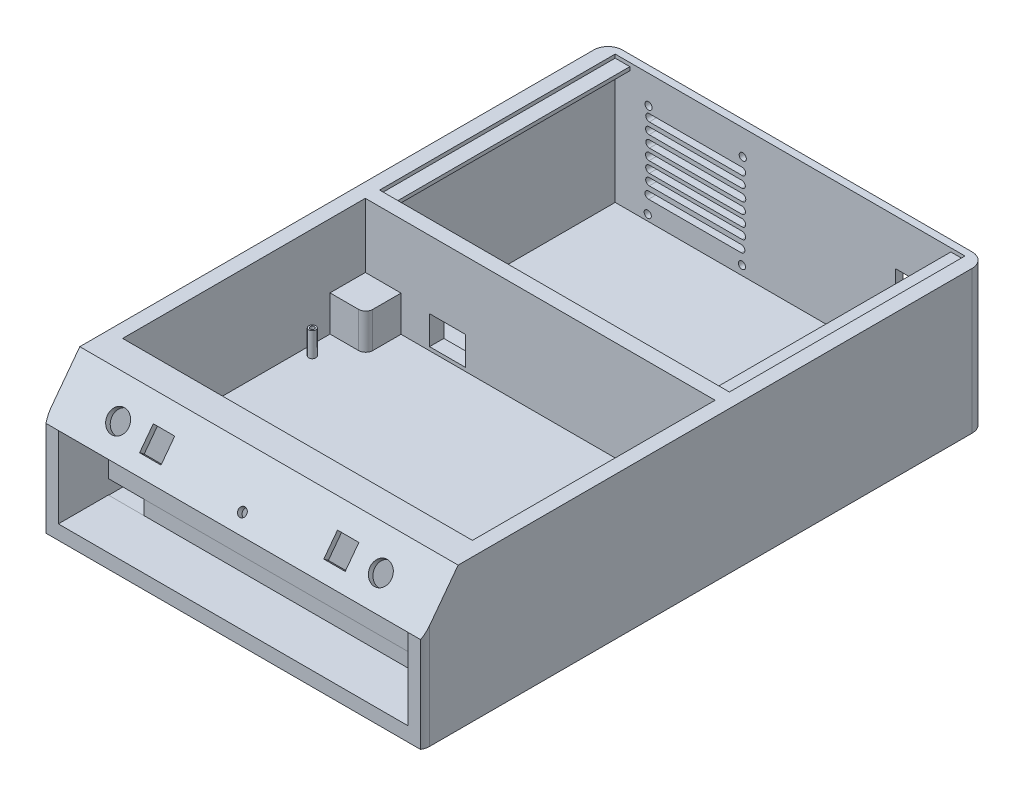
from build123d import *

# Parameters (mm, degrees)
BOSS_EXTRUDE2_DEPTH      = 100
SKETCH4_W                = 245
SKETCH4_H                = 170
CUT_EXTRUDE2_DEPTH       = 70
CUT_EXTRUDE12_DEPTH      = 434.077648927
CUT_EXTRUDE12_DEPTH_BACK = 434.077648927
CUT_EXTRUDE13_DEPTH      = 122.5
CUT_EXTRUDE14_DEPTH      = 122.5
SKETCH16_R               = 2.5
SKETCH16_R_2             = 2.25
SKETCH16_W               = 28.5
SKETCH16_H               = 48
CUT_EXTRUDE15_DEPTH      = 30
SKETCH17_R               = 2.952889484
SKETCH17_R_2             = 7.5
SKETCH17_W               = 15
SKETCH17_H               = 16
CUT_EXTRUDE16_DEPTH      = 10
BOSS_EXTRUDE3_DEPTH      = 25
SKETCH19_W               = 25
SKETCH19_H               = 20
CUT_EXTRUDE17_DEPTH      = 15
SKETCH21_W               = 195.080232819
SKETCH21_H               = 190
BOSS_EXTRUDE9_DEPTH      = 10
SKETCH23_W               = 265
SKETCH23_H               = 73.333333333
CUT_EXTRUDE18_DEPTH      = 5
SKETCH24_W               = 245
SKETCH24_H               = 56.666666667
CUT_EXTRUDE19_DEPTH      = 5
SKETCH25_W               = 245
SKETCH25_H               = 165
CUT_EXTRUDE21_DEPTH      = 2.5
SKETCH26_W               = 224.830514278
SKETCH26_H               = 165
CUT_EXTRUDE22_DEPTH      = 2.5
SKETCH27_R               = 2.5
SKETCH27_R_2             = 1.5
BOSS_EXTRUDE11_DEPTH     = 17


with BuildPart() as part:
    # Sketch1 → Boss-Extrude2 (new body)
    with BuildSketch(Plane(origin=(0, 0, 0), x_dir=(1, 0, 0), z_dir=(0, 1, 0))):
        with BuildLine():
            Line((0, -10), (0, -390))
            ThreePointArc((0, -390), (2.928932188, -397.071067812), (10, -400))
            Line((10, -400), (255, -400))
            ThreePointArc((255, -400), (262.071067812, -397.071067812), (265, -390))
            Line((265, -390), (265, -10))
            ThreePointArc((265, -10), (262.071067812, -2.928932188), (255, 0))
            Line((255, 0), (10, 0))
            ThreePointArc((10, 0), (2.928932188, -2.928932188), (0, -10))
        make_face()
    extrude(amount=BOSS_EXTRUDE2_DEPTH)

    # Sketch4 → Cut-Extrude2 (cut)
    with BuildSketch(Plane(origin=(0, 100, 0), x_dir=(1, 0, 0), z_dir=(0, 1, 0))):
        with Locations((132.5, -265)):
            Rectangle(SKETCH4_W, SKETCH4_H)
    extrude(amount=-CUT_EXTRUDE2_DEPTH, mode=Mode.SUBTRACT)

    # Sketch10 → Cut-Extrude12 (cut, two sides: drawn at the far end of the back side and taken through both)
    with BuildSketch(Plane(origin=(132.5, 0, 0), x_dir=(0, 0, -1), z_dir=(1, 0, 0)).offset(-CUT_EXTRUDE12_DEPTH_BACK)):
        Polygon((-400, 60), (-370, 100), (-400, 100), align=None)
    extrude(amount=CUT_EXTRUDE12_DEPTH + CUT_EXTRUDE12_DEPTH_BACK, mode=Mode.SUBTRACT)

    # Sketch14 → Cut-Extrude13 (cut, symmetric)
    with BuildSketch(Plane(origin=(132.5, 0, 0), x_dir=(0, 0, -1), z_dir=(1, 0, 0))):
        Polygon((-390, 10), (-360, 10), (-360, 96), (-368, 96), (-390, 66.666666667), align=None)
    extrude(amount=CUT_EXTRUDE13_DEPTH, both=True, mode=Mode.SUBTRACT)

    # Sketch15 → Cut-Extrude14 (cut, symmetric)
    with BuildSketch(Plane(origin=(132.5, 0, 0), x_dir=(0, 0, -1), z_dir=(1, 0, 0))):
        Polygon((-360, 9.784104138), (-360, 20), (-170, 20), (-170, 95), (-5, 95), (-5, 10), align=None)
    extrude(amount=CUT_EXTRUDE14_DEPTH, both=True, mode=Mode.SUBTRACT)

    # Sketch16 → Cut-Extrude15 (cut)
    with BuildSketch(Plane(origin=(0, 0, 0), x_dir=(-1, 0, 0), z_dir=(0, 0, -1))):
        with Locations((-99.351479045, 82.346777086)):
            Circle(SKETCH16_R)
        with Locations((-32.789304606, 14.265780679)):
            Circle(SKETCH16_R)
        with Locations((-33.351479045, 80.263386392)):
            Circle(SKETCH16_R)
        with Locations((-98.789304606, 16.349171373)):
            Circle(SKETCH16_R)
        with Locations((-241, 44.598834986)):
            Circle(SKETCH16_R_2)
        with Locations((-201, 44.598834986)):
            Circle(SKETCH16_R_2)
        with BuildLine():
            Line((-98.891846609, 75.787809753), (-33.891846609, 75.787809753))
            ThreePointArc((-33.891846609, 75.787809753), (-31.391846609, 73.287809753), (-33.891846609, 70.787809753))
            Line((-33.891846609, 70.787809753), (-98.891846609, 70.787809753))
            ThreePointArc((-98.891846609, 70.787809753), (-101.391846609, 73.287809753), (-98.891846609, 75.787809753))
        make_face()
        with BuildLine():
            Line((-98.710582977, 67.787809753), (-33.710582977, 67.787809753))
            ThreePointArc((-33.710582977, 67.787809753), (-31.292813717, 65.370040492), (-33.710582977, 62.952271231))
            Line((-33.710582977, 62.952271231), (-98.710582977, 62.952271231))
            ThreePointArc((-98.710582977, 62.952271231), (-101.128352238, 65.370040492), (-98.710582977, 67.787809753))
        make_face()
        with BuildLine():
            Line((-98.976192668, 59.952271231), (-33.976192668, 59.952271231))
            ThreePointArc((-33.976192668, 59.952271231), (-31.476192668, 57.452271231), (-33.976192668, 54.952271231))
            Line((-33.976192668, 54.952271231), (-98.976192668, 54.952271231))
            ThreePointArc((-98.976192668, 54.952271231), (-101.476192668, 57.452271231), (-98.976192668, 59.952271231))
        make_face()
        with BuildLine():
            Line((-98.733660424, 52.195845601), (-33.733660424, 52.195845601))
            ThreePointArc((-33.733660424, 52.195845601), (-31.233660424, 49.695845601), (-33.733660424, 47.195845601))
            Line((-33.733660424, 47.195845601), (-98.733660424, 47.195845601))
            ThreePointArc((-98.733660424, 47.195845601), (-101.233660424, 49.695845601), (-98.733660424, 52.195845601))
        make_face()
        with BuildLine():
            Line((-98.864643365, 44.598834986), (-33.864643365, 44.598834986))
            ThreePointArc((-33.864643365, 44.598834986), (-31.364643365, 42.098834986), (-33.864643365, 39.598834986))
            Line((-33.864643365, 39.598834986), (-98.864643365, 39.598834986))
            ThreePointArc((-98.864643365, 39.598834986), (-101.364643365, 42.098834986), (-98.864643365, 44.598834986))
        make_face()
        with BuildLine():
            Line((-98.864643365, 37.00182437), (-33.864643365, 37.00182437))
            ThreePointArc((-33.864643365, 37.00182437), (-31.364643365, 34.50182437), (-33.864643365, 32.00182437))
            Line((-33.864643365, 32.00182437), (-98.864643365, 32.00182437))
            ThreePointArc((-98.864643365, 32.00182437), (-101.364643365, 34.50182437), (-98.864643365, 37.00182437))
        make_face()
        with BuildLine():
            Line((-98.340711599, 28.618916104), (-33.340711599, 28.618916104))
            ThreePointArc((-33.340711599, 28.618916104), (-30.840711599, 26.118916104), (-33.340711599, 23.618916104))
            Line((-33.340711599, 23.618916104), (-98.340711599, 23.618916104))
            ThreePointArc((-98.340711599, 23.618916104), (-100.840711599, 26.118916104), (-98.340711599, 28.618916104))
        make_face()
        with Locations((-220.75, 44)):
            Rectangle(SKETCH16_W, SKETCH16_H)
    extrude(amount=-CUT_EXTRUDE15_DEPTH, mode=Mode.SUBTRACT)

    # Sketch17 → Cut-Extrude16 (cut)
    with BuildSketch(Plane(origin=(0, 213.6, 284.8), x_dir=(1, 0, 0), z_dir=(0, 0.5999999999999998, 0.8000000000000004))):
        with Locations(Location((132.5, -173, 0), (0, 0, 270))):
            Circle(SKETCH17_R)
        with Locations(Location((40.5, -164.727732251, 0), (0, 0, 270))):
            Circle(SKETCH17_R_2)
        with Locations(Location((224.5, -164.727732251, 0), (0, 0, 270))):
            Circle(SKETCH17_R_2)
        with Locations((68, -165)):
            Rectangle(SKETCH17_W, SKETCH17_H)
        with Locations((197, -165)):
            Rectangle(SKETCH17_W, SKETCH17_H)
    extrude(amount=-CUT_EXTRUDE16_DEPTH, mode=Mode.SUBTRACT)

    # Sketch18 → Boss-Extrude3 (add)
    with BuildSketch(Plane(origin=(0, 30, 0), x_dir=(1, 0, 0), z_dir=(0, 1, 0))):
        with BuildLine():
            Line((10, -180), (10, -204.729927007))
            Line((10, -204.729927007), (30, -204.729927007))
            ThreePointArc((30, -204.729927007), (33.43872324, -203.359690427), (34.99270073, -200))
            Line((34.99270073, -200), (34.99270073, -180))
            Line((34.99270073, -180), (10, -180))
        make_face()
        with BuildLine():
            Line((255, -350), (255, -324.14910859))
            Line((255, -324.14910859), (235, -324.14910859))
            ThreePointArc((235, -324.14910859), (231.175444009, -325.928429861), (230.072933549, -330))
            Line((230.072933549, -330), (230.072933549, -350))
            Line((230.072933549, -350), (255, -350))
        make_face()
    extrude(amount=BOSS_EXTRUDE3_DEPTH)

    # Sketch19 → Cut-Extrude17 (cut)
    with BuildSketch(Plane.XY.offset(180)):
        with Locations((67.49270073, 42.5)):
            Rectangle(SKETCH19_W, SKETCH19_H)
    extrude(amount=-CUT_EXTRUDE17_DEPTH, mode=Mode.SUBTRACT)

    # Sketch23 → Cut-Extrude18 (cut)
    with BuildSketch(Plane.XY.offset(400)):
        with Locations((132.5, 36.666666666)):
            Rectangle(SKETCH23_W, SKETCH23_H)
    extrude(amount=-CUT_EXTRUDE18_DEPTH, mode=Mode.SUBTRACT)

    # Sketch24 → Cut-Extrude19 (cut)
    with BuildSketch(Plane.XY.offset(395)):
        with Locations((132.5, 38.333333334)):
            Rectangle(SKETCH24_W, SKETCH24_H)
    extrude(amount=-CUT_EXTRUDE19_DEPTH, mode=Mode.SUBTRACT)

    # Sketch25 → Cut-Extrude21 (cut)
    with BuildSketch(Plane(origin=(0, 100, 0), x_dir=(1, 0, 0), z_dir=(0, 1, 0))):
        with Locations((132.5, -87.5)):
            Rectangle(SKETCH25_W, SKETCH25_H)
    extrude(amount=-CUT_EXTRUDE21_DEPTH, mode=Mode.SUBTRACT)

    # Sketch26 → Cut-Extrude22 (cut)
    with BuildSketch(Plane(origin=(0, 97.5, 0), x_dir=(1, 0, 0), z_dir=(0, 1, 0))):
        with Locations((132.6965421, -87.5)):
            Rectangle(SKETCH26_W, SKETCH26_H)
    extrude(amount=-CUT_EXTRUDE22_DEPTH, mode=Mode.SUBTRACT)

    # Sketch27 → Boss-Extrude11 (add)
    # profile 1 of 4: a face of its own
    with BuildSketch(Plane(origin=(0, 30, 0), x_dir=(1, 0, 0), z_dir=(0, 1, 0))):
        with Locations(Location((248, -304.14910859, 0), (0, 0, 270))):
            Circle(SKETCH27_R)
        with Locations(Location((248, -304.14910859, 0), (0, 0, 270))):
            Circle(SKETCH27_R_2, mode=Mode.SUBTRACT)
    # profile 2 of 4: a face of its own
    with BuildSketch(Plane(origin=(0, 30, 0), x_dir=(1, 0, 0), z_dir=(0, 1, 0))):
        with Locations(Location((248, -224.14910859, 0), (0, 0, 270))):
            Circle(SKETCH27_R)
        with Locations(Location((248, -224.14910859, 0), (0, 0, 270))):
            Circle(SKETCH27_R_2, mode=Mode.SUBTRACT)
    # profile 3 of 4: a face of its own
    with BuildSketch(Plane(origin=(0, 30, 0), x_dir=(1, 0, 0), z_dir=(0, 1, 0))):
        with Locations(Location((17, -304.14910859, 0), (0, 0, 270))):
            Circle(SKETCH27_R)
        with Locations(Location((17, -304.14910859, 0), (0, 0, 270))):
            Circle(SKETCH27_R_2, mode=Mode.SUBTRACT)
    # profile 4 of 4: a face of its own
    with BuildSketch(Plane(origin=(0, 30, 0), x_dir=(1, 0, 0), z_dir=(0, 1, 0))):
        with Locations(Location((17, -224.14910859, 0), (0, 0, 270))):
            Circle(SKETCH27_R)
        with Locations(Location((17, -224.14910859, 0), (0, 0, 270))):
            Circle(SKETCH27_R_2, mode=Mode.SUBTRACT)
    extrude(amount=BOSS_EXTRUDE11_DEPTH)


with BuildPart() as body_2:
    # Sketch21 → Boss-Extrude9 (new body)
    with BuildSketch(Plane.XZ.offset(-20)):
        with Locations((132.53281714, 265)):
            Rectangle(SKETCH21_W, SKETCH21_H)
    extrude(amount=BOSS_EXTRUDE9_DEPTH)


solid = Compound([part.part, body_2.part])
